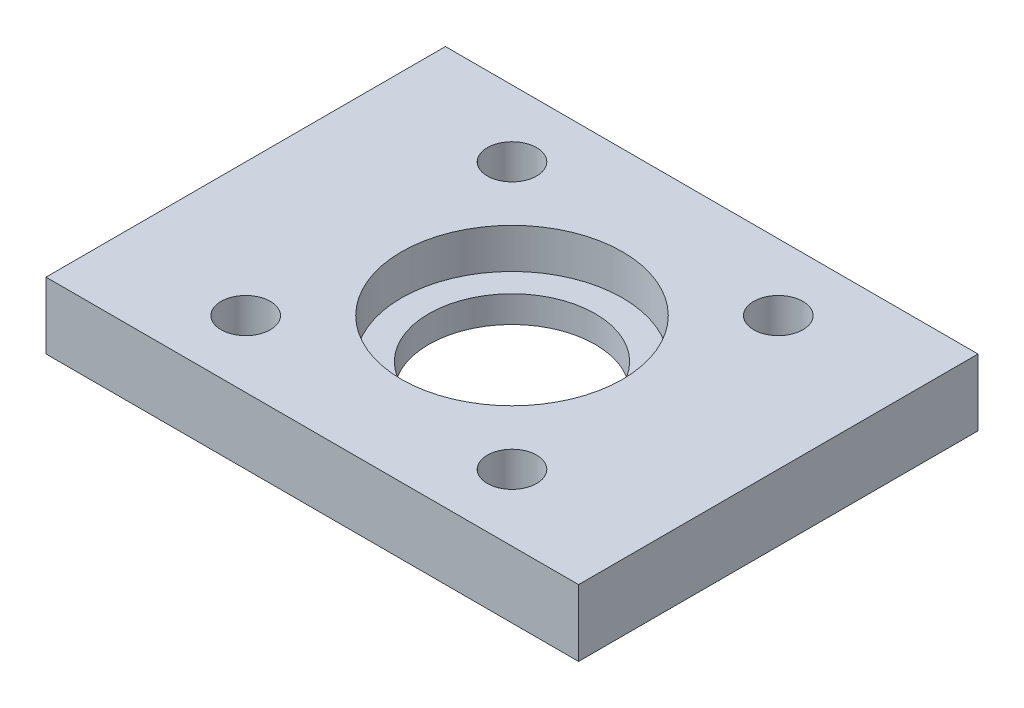
from build123d import *

# Parameters (mm, degrees)
SKETCH1_W            = 40
SKETCH1_H            = 30
SKETCH1_R            = 6.25
BODY_DEPTH           = 2
SKETCH2_W            = 40
SKETCH2_H            = 30
SKETCH2_R            = 8.3
BEARINGS_PLACE_DEPTH = 3
SKETCH3_R            = 1.85
INSERTS_PLACE_DEPTH  = 4


with BuildPart() as part:
    # Sketch1 → Body (new body)
    with BuildSketch(Plane(origin=(0, 0, 0), x_dir=(1, 0, 0), z_dir=(0, 1, 0))):
        Rectangle(SKETCH1_W, SKETCH1_H)
        with Locations(Location((0, 0, 0), (0, 0, 270))):
            Circle(SKETCH1_R, mode=Mode.SUBTRACT)
    extrude(amount=BODY_DEPTH)

    # Sketch2 → Bearings_Place (add)
    with BuildSketch(Plane(origin=(0, 2, 0), x_dir=(1, 0, 0), z_dir=(0, 1, 0))):
        Rectangle(SKETCH2_W, SKETCH2_H)
        with Locations(Location((0, 0, 0), (0, 0, 270))):
            Circle(SKETCH2_R, mode=Mode.SUBTRACT)
    extrude(amount=BEARINGS_PLACE_DEPTH)

    # Sketch3 → Inserts_Place (cut)
    with BuildSketch(Plane(origin=(0, 5, 0), x_dir=(1, 0, 0), z_dir=(0, 1, 0))):
        with Locations(Location((-10, 10, 0), (0, 0, 270))):
            Circle(SKETCH3_R)
        with Locations(Location((10, 10, 0), (0, 0, 270))):
            Circle(SKETCH3_R)
        with Locations(Location((10, -10, 0), (0, 0, 270))):
            Circle(SKETCH3_R)
        with Locations(Location((-10, -10, 0), (0, 0, 270))):
            Circle(SKETCH3_R)
    extrude(amount=-INSERTS_PLACE_DEPTH, mode=Mode.SUBTRACT)


solid = part.part
